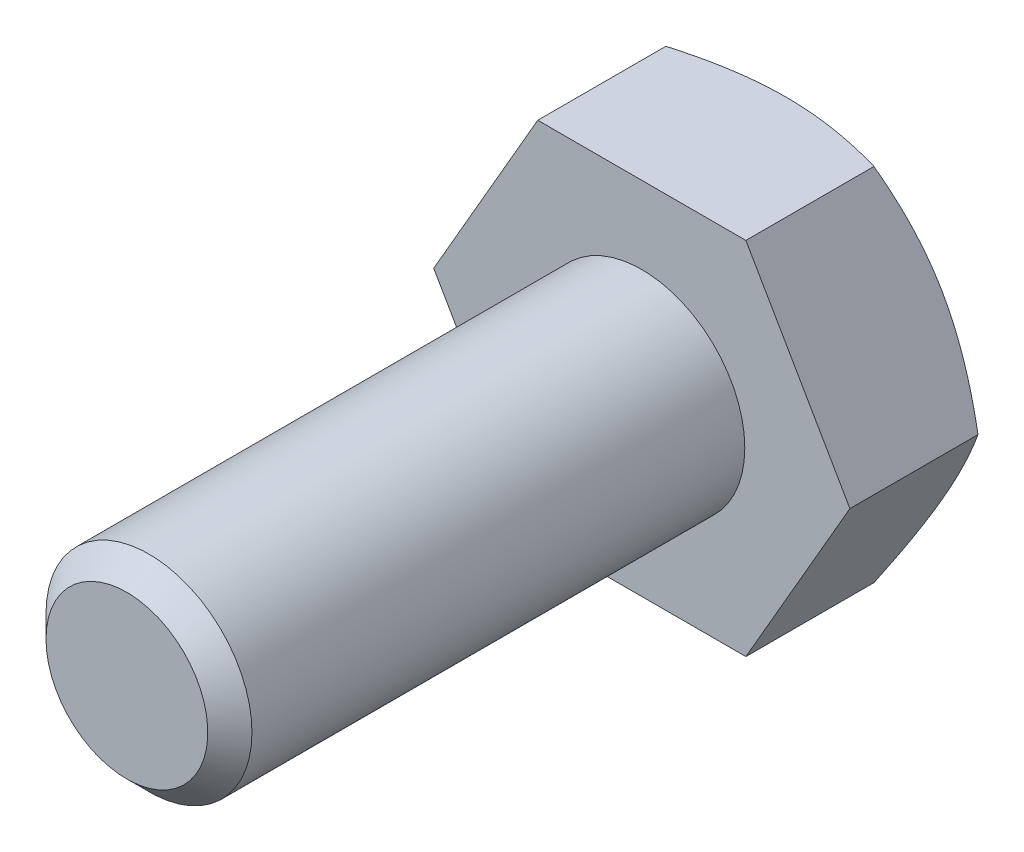
from build123d import *

# Parameters (mm, degrees)
EXTRUDE1_DEPTH = 2.8
SKETCH2_R      = 2
EXTRUDE2_DEPTH = 10
CHAMFER1_SIZE  = 0.429


with BuildPart() as part:
    # Sketch1 → Extrude1 (new body)
    with BuildSketch(Plane.XY):
        Polygon((4.041451884, 0), (2.020725942, 3.5), (-2.020725942, 3.5), (-4.041451884, 0), (-2.020725942, -3.5), (2.020725942, -3.5), align=None)
    extrude(amount=EXTRUDE1_DEPTH)

    # Sketch2 → Extrude2 (add)
    with BuildSketch(Plane.XY.offset(2.8)):
        Circle(SKETCH2_R)
    extrude(amount=EXTRUDE2_DEPTH)

    # Sketch3 → Cut-Revolve1 (revolve, cut)
    with BuildSketch(Plane(origin=(0, 0, 0), x_dir=(0, 0, -1), z_dir=(1, 0, 0))):
        Polygon((0, 3.5), (0, 103.5), (-57.735026919, 103.5), align=None)
    revolve(axis=Axis((0, 0, 0), (0, 0, -1)), mode=Mode.SUBTRACT)

    # Chamfer1
    chamfer1_edges = [part.edges().sort_by_distance(p)[0] for p in [
        (-2, 0, 12.8),
    ]]
    chamfer(chamfer1_edges, length=CHAMFER1_SIZE)


solid = part.part
